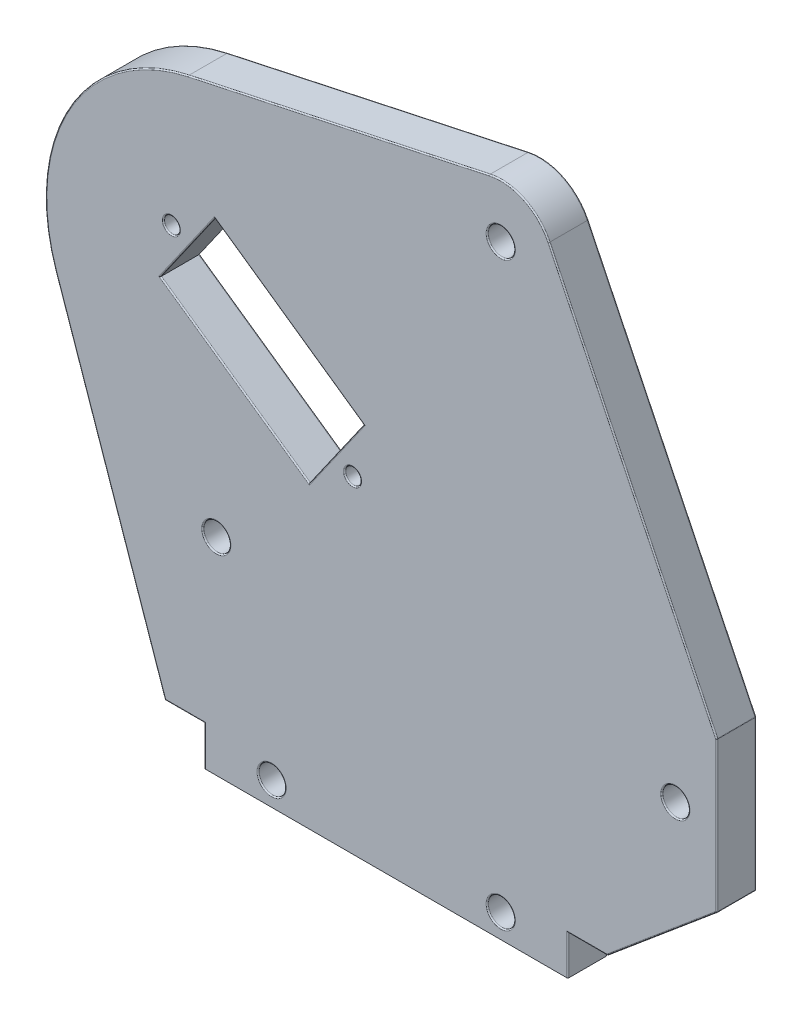
from build123d import *

# Parameters (mm, degrees)
SKETCH1_R            = 1
BOSS_EXTRUDE2_DEPTH  = 5
M3_CLEARANCE_HOLE1_D = 3.4
FILLET1_R            = 0.15
SKETCH13_W           = 46
SKETCH13_H           = 5
CUT_EXTRUDE1_DEPTH   = 99.37328461


with BuildPart() as part:
    # Sketch1 → Boss-Extrude2 (new body)
    with BuildSketch(Plane.XY):
        with BuildLine():
            Line((41.85, 40.621529892), (20.610605748, 84.460506273))
            ThreePointArc((20.610605748, 84.460506273), (17.477220077, 87.602479874), (13.072325527, 88.138211024))
            Line((13.072325527, 88.138211024), (-25.029728066, 79.943634341))
            ThreePointArc((-25.029728066, 79.943634341), (-40.146654928, 68.813612437), (-41.843761624, 50.118193368))
            Line((-41.843761624, 50.118193368), (-28, 10))
            Line((-28, 10), (-23, 10))
            Line((-23, 10), (-23, 0))
            Line((-23, 0), (23, 0))
            Line((23, 0), (23, 10))
            Line((23, 10), (28, 10))
            Line((28, 10), (41.85, 21.621529892))
            Line((41.85, 21.621529892), (41.85, 40.621529892))
        make_face()
        with Locations((-27.182792376, 62.455399709)):
            Circle(SKETCH1_R, mode=Mode.SUBTRACT)
        with Locations(Location((-4.246535136, 46.395259491, 0), (0, 0, 180))):
            Circle(SKETCH1_R, mode=Mode.SUBTRACT)
        Polygon((-21.693453648, 65.936370884), (-28.576370884, 56.106546352), (-9.735873865, 42.914288316), (-2.852956629, 52.744112848), align=None, mode=Mode.SUBTRACT)
    extrude(amount=BOSS_EXTRUDE2_DEPTH)

    # M3 Clearance Hole1 (through all)
    with Locations(Plane.XY.offset(5)):
        with Locations((14.5, 81.5), (36.6, 31.121529892), (14.5, 8), (-14.5, 8), (-21.5, 31.121529892)):
            Hole(M3_CLEARANCE_HOLE1_D / 2)

    # Fillet1
    fillet1_edges = [part.edges().sort_by_distance(p)[0] for p in [
        (31.230302874, 62.541018083, 0),
        (41.85, 31.121529892, 0),
        (-40.146654928, 68.813612437, 5),
        (34.925, 15.810764946, 0),
        (25.5, 10, 0),
        (23, 5, 0),
        (0, 0, 0),
        (-23, 5, 0),
        (-25.5, 10, 0),
        (-34.921880812, 30.059096684, 0),
        (-40.146654928, 68.813612437, 0),
        (-5.978701269, 84.040922682, 0),
        (17.477220077, 87.602479874, 0),
        (-34.921880812, 30.059096684, 5),
        (41.85, 40.621529892, 2.5),
        (41.85, 21.621529892, 2.5),
        (-25.5, 10, 5),
        (28, 10, 2.5),
        (23, 0, 2.5),
        (-23, 0, 2.5),
        (-28, 10, 2.5),
        (-23, 5, 5),
        (0, 0, 5),
        (23, 5, 5),
        (-12.273205138, 59.340241866, 0),
        (-25.134912266, 61.021458618, 0),
        (-19.156122375, 49.510417334, 0),
        (-6.294415247, 47.829200582, 0),
        (-12.273205138, 59.340241866, 5),
        (-25.134912266, 61.021458618, 5),
        (-19.156122375, 49.510417334, 5),
        (-6.294415247, 47.829200582, 5),
        (25.5, 10, 5),
        (34.925, 15.810764946, 5),
        (-28.182792376, 62.455399709, 0),
        (-28.182792376, 62.455399709, 5),
        (41.85, 31.121529892, 5),
        (-3.246535136, 46.395259491, 0),
        (-3.246535136, 46.395259491, 5),
        (31.230302874, 62.541018083, 5),
        (17.477220077, 87.602479874, 5),
        (-19.8, 31.121529892, 5),
        (-19.8, 31.121529892, 0),
        (-12.8, 8, 5),
        (-12.8, 8, 0),
        (16.2, 8, 5),
        (16.2, 8, 0),
        (38.3, 31.121529892, 5),
        (38.3, 31.121529892, 0),
        (16.2, 81.5, 5),
        (16.2, 81.5, 0),
        (-5.978701269, 84.040922682, 5),
    ]]
    fillet(fillet1_edges, radius=FILLET1_R)

    # Sketch13 → Cut-Extrude1 (cut, through all)
    with BuildSketch(Plane.XY.offset(5)):
        with Locations((0, 2.5)):
            Rectangle(SKETCH13_W, SKETCH13_H)
    extrude(amount=-CUT_EXTRUDE1_DEPTH, mode=Mode.SUBTRACT)


solid = part.part
